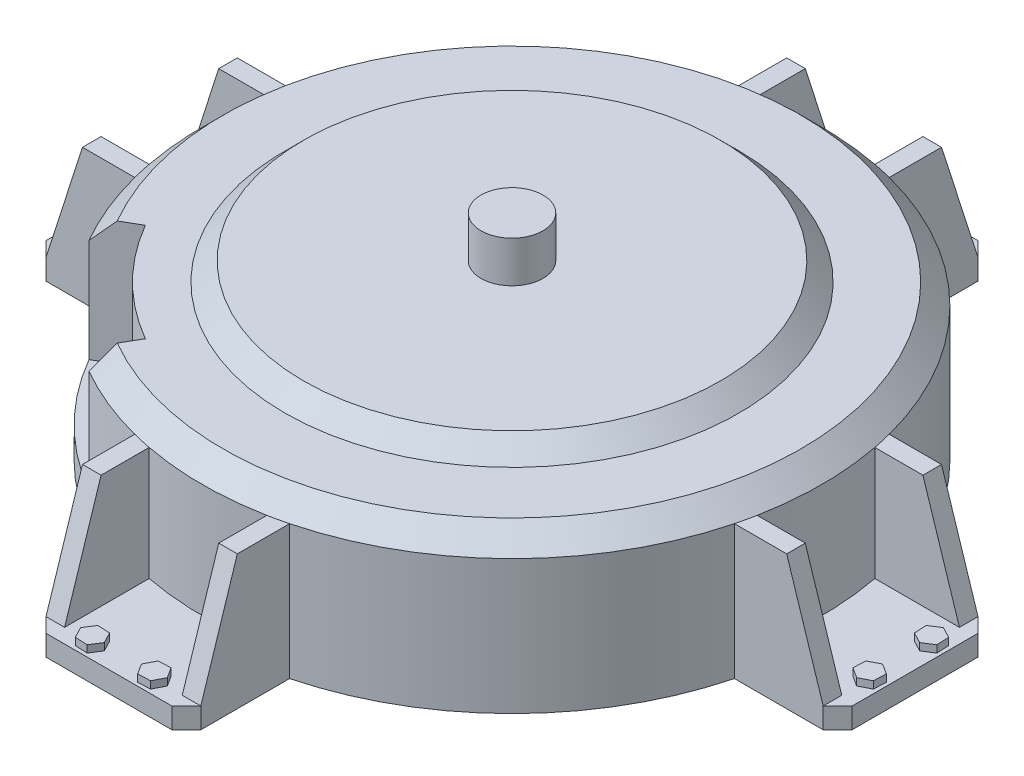
from build123d import *

# Parameters (mm, degrees)
SKETCH1_R                    = 150
BOSS_EXTRUDE1_DEPTH          = 75
CHAMFER1_SIZE                = 10
BOSS_EXTRUDE2_START          = -75
BOSS_EXTRUDE2_DEPTH          = 10
CHAMFER2_SIZE                = 7
BOSS_EXTRUDE3_DEPTH          = 9
BOSS_EXTRUDE4_DEPTH          = 3.5
CIRPATTERN2_COUNT            = 4
CIRPATTERN2_COPY_1_DEPTH     = 9
CIRPATTERN2_COPY_2_DEPTH     = 9
CIRPATTERN2_COPY_3_DEPTH     = 9
CIRPATTERN2_COPY_4_DEPTH     = 3.5
CIRPATTERN2_COPY_5_DEPTH     = 3.5
CIRPATTERN2_COPY_6_DEPTH     = 3.5
CHAMFER2_OF_CIRPATTERN2_SIZE = 7
CUT_EXTRUDE2_START           = -60
CUT_EXTRUDE2_DEPTH           = 60
SKETCH7_R                    = 110
BOSS_EXTRUDE5_DEPTH          = 9
BOSS_EXTRUDE5_TAPER          = 45
SKETCH8_R                    = 15
BOSS_EXTRUDE6_DEPTH          = 20


with BuildPart() as part:
    # Sketch1 → Boss-Extrude1 (new body)
    with BuildSketch(Plane(origin=(0, 0, 0), x_dir=(1, 0, 0), z_dir=(0, 1, 0))):
        with Locations(Location((0, 0, 0), (0, 0, 270))):
            Circle(SKETCH1_R)
    extrude(amount=BOSS_EXTRUDE1_DEPTH)

    # Chamfer1
    chamfer1_edges = [part.edges().sort_by_distance(p)[0] for p in [
        (0, 75, -150),
    ]]
    chamfer(chamfer1_edges, length=CHAMFER1_SIZE)

    # Sketch2 → Boss-Extrude2 (add)
    with BuildSketch(Plane(origin=(0, 75, 0), x_dir=(1, 0, 0), z_dir=(0, 1, 0)).offset(BOSS_EXTRUDE2_START)):
        with BuildLine():
            Line((-145.236875483, 37.5), (-195.236875483, 37.5))
            Line((-195.236875483, 37.5), (-195.236875483, -37.5))
            Line((-195.236875483, -37.5), (-145.236875483, -37.5))
            ThreePointArc((-145.236875483, -37.5), (-150, 0), (-145.236875483, 37.5))
        make_face()
    boss_extrude2 = extrude(amount=BOSS_EXTRUDE2_DEPTH)

    # Chamfer2
    chamfer2_edges = [part.edges().sort_by_distance(p)[0] for p in [
        (-195.236875483, 5, -37.5),
        (-195.236875483, 5, 37.5),
    ]]
    chamfer(chamfer2_edges, length=CHAMFER2_SIZE)

    # Sketch4 → Boss-Extrude3 (add)
    with BuildSketch(Plane.XY.offset(37.5)):
        Polygon((-188.236875483, 10), (-145.236875483, 10), (-145.236875483, 65), (-170.556875483, 65), align=None)
    boss_extrude3 = extrude(amount=-BOSS_EXTRUDE3_DEPTH)

    # Sketch5 → Boss-Extrude4 (add)
    with BuildSketch(Plane(origin=(0, 10, 0), x_dir=(1, 0, 0), z_dir=(0, 1, 0))):
        Polygon((-183.173956068, -11.769233661), (-188.503341499, -9), (-193.566260913, -12.230766339), (-193.299794898, -18.230766339), (-187.970409467, -21), (-182.907490052, -17.769233661), align=None)
    boss_extrude4 = extrude(amount=BOSS_EXTRUDE4_DEPTH)

    # Mirror1: Boss-Extrude3, Boss-Extrude4 across plane
    add(boss_extrude3.mirror(Plane.XY))
    add(boss_extrude4.mirror(Plane.XY))

    # CirPattern2: Boss-Extrude2, Boss-Extrude3, Boss-Extrude4 ×4 about axis
    cirpattern2_axis = Axis((0, 0, 0), (0, 1, 0))
    add([boss_extrude2.rotate(cirpattern2_axis, i * 360 / CIRPATTERN2_COUNT) for i in range(1, CIRPATTERN2_COUNT)])
    add([boss_extrude3.rotate(cirpattern2_axis, i * 360 / CIRPATTERN2_COUNT) for i in range(1, CIRPATTERN2_COUNT)])
    add([boss_extrude4.rotate(cirpattern2_axis, i * 360 / CIRPATTERN2_COUNT) for i in range(1, CIRPATTERN2_COUNT)])

    # CirPattern2 copy 1 sketch → CirPattern2 copy 1 (add)
    with BuildSketch(Plane(origin=(-37.5, 0, 0), x_dir=(0, 0, -1), z_dir=(-1, 0, 0))):
        Polygon((-188.236875483, -10), (-145.236875483, -10), (-145.236875483, -65), (-170.556875483, -65), align=None)
    extrude(amount=-CIRPATTERN2_COPY_1_DEPTH)

    # CirPattern2 copy 2 sketch → CirPattern2 copy 2 (add)
    with BuildSketch(Plane(origin=(0, 0, 37.5), x_dir=(-1, 0, 0), z_dir=(0, 0, 1))):
        Polygon((-188.236875483, -10), (-145.236875483, -10), (-145.236875483, -65), (-170.556875483, -65), align=None)
    extrude(amount=-CIRPATTERN2_COPY_2_DEPTH)

    # CirPattern2 copy 3 sketch → CirPattern2 copy 3 (add)
    with BuildSketch(Plane(origin=(37.5, 0, 0), x_dir=(0, 0, 1), z_dir=(1, 0, 0))):
        Polygon((-188.236875483, -10), (-145.236875483, -10), (-145.236875483, -65), (-170.556875483, -65), align=None)
    extrude(amount=-CIRPATTERN2_COPY_3_DEPTH)

    # CirPattern2 copy 4 sketch → CirPattern2 copy 4 (add)
    with BuildSketch(Plane(origin=(0, 10, 0), x_dir=(0, 0, -1), z_dir=(0, 1, 0))):
        Polygon((-183.173956068, 11.769233661), (-188.503341499, 9), (-193.566260913, 12.230766339), (-193.299794898, 18.230766339), (-187.970409467, 21), (-182.907490052, 17.769233661), align=None)
    extrude(amount=CIRPATTERN2_COPY_4_DEPTH)

    # CirPattern2 copy 5 sketch → CirPattern2 copy 5 (add)
    with BuildSketch(Plane(origin=(0, 10, 0), x_dir=(-1, 0, 0), z_dir=(0, 1, 0))):
        Polygon((-183.173956068, 11.769233661), (-188.503341499, 9), (-193.566260913, 12.230766339), (-193.299794898, 18.230766339), (-187.970409467, 21), (-182.907490052, 17.769233661), align=None)
    extrude(amount=CIRPATTERN2_COPY_5_DEPTH)

    # CirPattern2 copy 6 sketch → CirPattern2 copy 6 (add)
    with BuildSketch(Plane.ZX.offset(10)):
        Polygon((-183.173956068, 11.769233661), (-188.503341499, 9), (-193.566260913, 12.230766339), (-193.299794898, 18.230766339), (-187.970409467, 21), (-182.907490052, 17.769233661), align=None)
    extrude(amount=CIRPATTERN2_COPY_6_DEPTH)

    # Chamfer2 of CirPattern2
    chamfer2_of_cirpattern2_edges = [part.edges().sort_by_distance(p)[0] for p in [
        (-37.5, 5, 195.236875483),
        (37.5, 5, 195.236875483),
        (195.236875483, 5, 37.5),
        (195.236875483, 5, -37.5),
        (37.5, 5, -195.236875483),
        (-37.5, 5, -195.236875483),
    ]]
    chamfer(chamfer2_of_cirpattern2_edges, length=CHAMFER2_OF_CIRPATTERN2_SIZE)

    # Sketch6 → Cut-Extrude2 (cut)
    with BuildSketch(Plane(origin=(0, 75, 0), x_dir=(1, 0, 0), z_dir=(0, 1, 0)).offset(CUT_EXTRUDE2_START)):
        with BuildLine():
            Line((-112.583302492, -65), (-129.903810568, -75))
            ThreePointArc((-129.903810568, -75), (-106.066017178, -106.066017178), (-75, -129.903810568))
            Line((-75, -129.903810568), (-65, -112.583302492))
            ThreePointArc((-65, -112.583302492), (-91.923881554, -91.923881554), (-112.583302492, -65))
        make_face()
    extrude(amount=CUT_EXTRUDE2_DEPTH, mode=Mode.SUBTRACT)

    # Sketch7 → Boss-Extrude5 (add)
    with BuildSketch(Plane(origin=(0, 75, 0), x_dir=(1, 0, 0), z_dir=(0, 1, 0))):
        Circle(SKETCH7_R)
    extrude(amount=BOSS_EXTRUDE5_DEPTH, taper=BOSS_EXTRUDE5_TAPER)

    # Sketch8 → Boss-Extrude6 (add)
    with BuildSketch(Plane(origin=(0, 84, 0), x_dir=(1, 0, 0), z_dir=(0, 1, 0))):
        with Locations(Location((0, 0, 0), (0, 0, 270))):
            Circle(SKETCH8_R)
    extrude(amount=BOSS_EXTRUDE6_DEPTH)


solid = part.part
